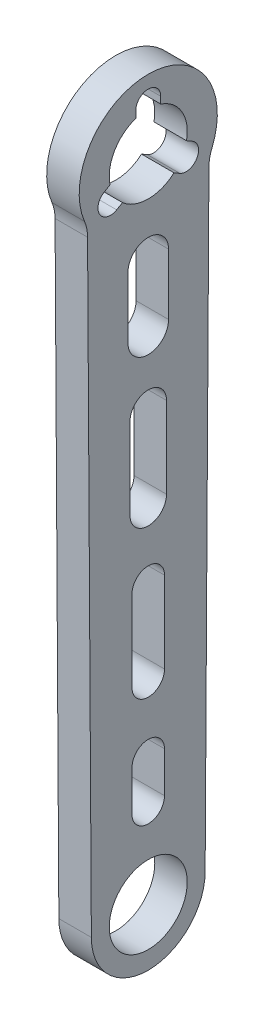
from build123d import *

# Parameters (mm, degrees)
SKETCH_3_R          = 9.6
EXTRUDE_1_DEPTH     = 8
CUT_EXTRUDE_3_DEPTH = 10
FILLET_1_R          = 10
CUT_EXTRUDE_4_DEPTH = 10


with BuildPart() as part:
    # 草图3 → 凸台-拉伸1 (new body)
    with BuildSketch(Plane(origin=(0, 0, 0), x_dir=(0, 0, -1), z_dir=(1, 0, 0))):
        with BuildLine():
            Line((14, -160), (14.949411629, -8.094139358))
            ThreePointArc((14.949411629, -8.094139358), (0, 17), (-14.949411629, -8.094139358))
            Line((-14.949411629, -8.094139358), (-14, -160))
            ThreePointArc((-14, -160), (0, -174), (14, -160))
        make_face()
        with Locations((0, -160)):
            Circle(SKETCH_3_R, mode=Mode.SUBTRACT)
    extrude(amount=EXTRUDE_1_DEPTH)

    # 草图6 → 切除-拉伸3 (cut)
    with BuildSketch(Plane(origin=(8, 0, 0), x_dir=(0, 0, -1), z_dir=(1, 0, 0))):
        with BuildLine():
            Line((5, -22.788825977), (5, -37.788825977))
            ThreePointArc((5, -37.788825977), (0, -42.788825977), (-5, -37.788825977))
            Line((-5, -37.788825977), (-5, -22.788825977))
            ThreePointArc((-5, -22.788825977), (0, -17.788825977), (5, -22.788825977))
        make_face()
        with BuildLine():
            Line((4.5, -54.788825977), (4.5, -74.788825977))
            ThreePointArc((4.5, -74.788825977), (0, -79.288825977), (-4.5, -74.788825977))
            Line((-4.5, -74.788825977), (-4.5, -54.788825977))
            ThreePointArc((-4.5, -54.788825977), (0, -50.288825977), (4.5, -54.788825977))
        make_face()
        with BuildLine():
            Line((4, -91.788825977), (4, -111.788825977))
            ThreePointArc((4, -111.788825977), (0, -115.788825977), (-4, -111.788825977))
            Line((-4, -111.788825977), (-4, -91.788825977))
            ThreePointArc((-4, -91.788825977), (0, -87.788825977), (4, -91.788825977))
        make_face()
        with BuildLine():
            Line((4, -128.788825977), (4, -138.788825977))
            ThreePointArc((4, -138.788825977), (0, -142.788825977), (-4, -138.788825977))
            Line((-4, -138.788825977), (-4, -128.788825977))
            ThreePointArc((-4, -128.788825977), (0, -124.788825977), (4, -128.788825977))
        make_face()
    extrude(amount=-CUT_EXTRUDE_3_DEPTH, mode=Mode.SUBTRACT)

    # 圆角1
    fillet_1_edges = [part.edges().sort_by_distance(p)[0] for p in [
        (4, -8.094139358, 14.949411629),
        (4, -8.094139358, -14.949411629),
    ]]
    fillet(fillet_1_edges, radius=FILLET_1_R)

    # 草图4 → 切除-拉伸4 (cut)
    with BuildSketch(Plane(origin=(8, 0, 0), x_dir=(0, 0, -1), z_dir=(1, 0, 0))):
        with BuildLine():
            Line((-3.071192312, 10.75), (-3.071192312, 9.095481174))
            ThreePointArc((-3.071192312, 9.095481174), (-8.313843876, 4.8), (-9.412513912, -1.888010025))
            Line((-9.412513912, -1.888010025), (-10.845369247, -2.715269438))
            ThreePointArc((-10.845369247, -2.715269438), (-11.969503653, -6.910596156), (-7.774176935, -8.034730562))
            Line((-7.774176935, -8.034730562), (-6.3413216, -7.207471149))
            ThreePointArc((-6.3413216, -7.207471149), (0, -9.6), (6.3413216, -7.207471149))
            Line((6.3413216, -7.207471149), (7.774176935, -8.034730562))
            ThreePointArc((7.774176935, -8.034730562), (11.969503653, -6.910596156), (10.845369247, -2.715269438))
            Line((10.845369247, -2.715269438), (9.412513912, -1.888010025))
            ThreePointArc((9.412513912, -1.888010025), (8.313843876, 4.8), (3.071192312, 9.095481174))
            Line((3.071192312, 9.095481174), (3.071192312, 10.75))
            ThreePointArc((3.071192312, 10.75), (0, 13.821192312), (-3.071192312, 10.75))
        make_face()
    extrude(amount=-CUT_EXTRUDE_4_DEPTH, mode=Mode.SUBTRACT)


solid = part.part
